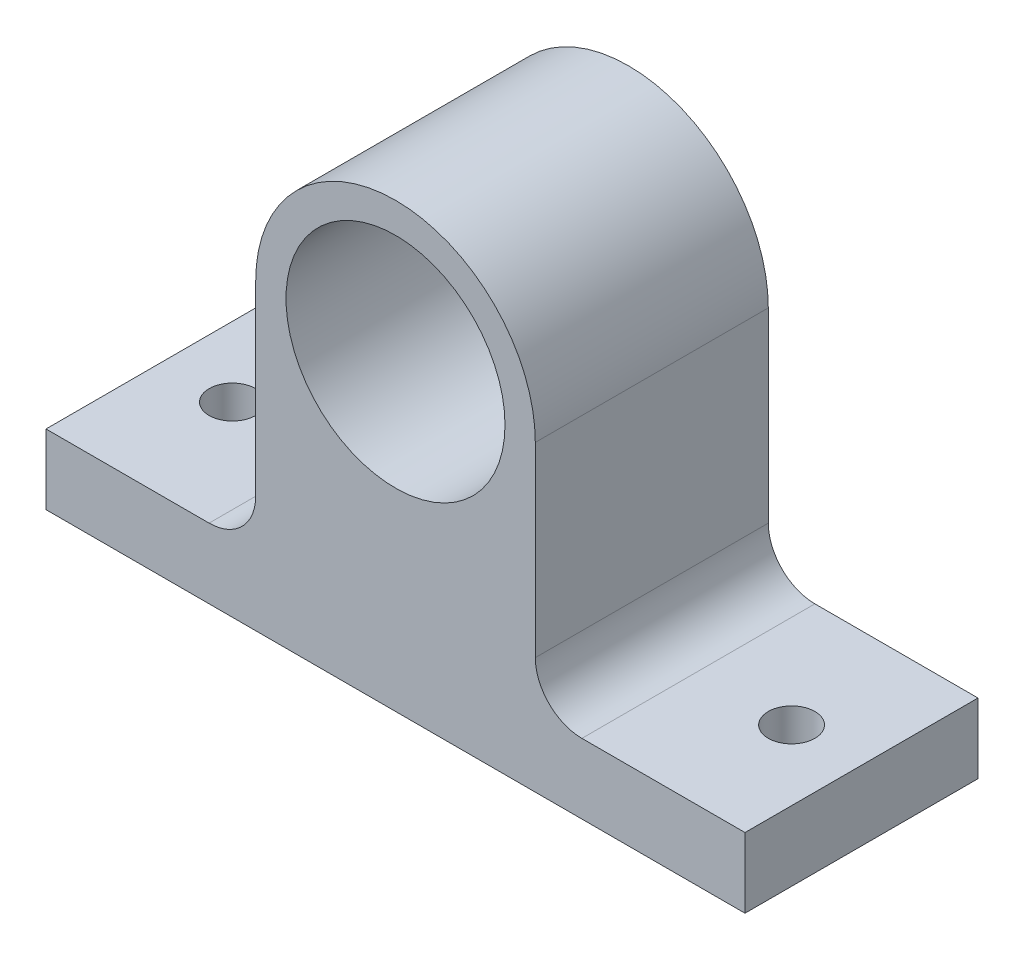
from build123d import *

# Parameters (mm, degrees)
IZIM1_R                     = 23.5
Y_KSEKLIK_EKSTR_ZYON1_DEPTH = 50
RADYUS1_R                   = 10
IZIM2_R                     = 5
KES_EKSTR_ZYON1_DEPTH       = 50


with BuildPart() as part:
    # Çizim1 → Yükseklik-Ekstrüzyon1 (new body)
    with BuildSketch(Plane.XY):
        with BuildLine():
            Line((-30, 7.5), (-30, 57.5))
            ThreePointArc((-30, 57.5), (0, 87.5), (30, 57.5))
            Line((30, 57.5), (30, 7.5))
            Line((30, 7.5), (75, 7.5))
            Line((75, 7.5), (75, -7.5))
            Line((75, -7.5), (-75, -7.5))
            Line((-75, -7.5), (-75, 7.5))
            Line((-75, 7.5), (-30, 7.5))
        make_face()
        with Locations((0, 57.5)):
            Circle(IZIM1_R, mode=Mode.SUBTRACT)
    extrude(amount=Y_KSEKLIK_EKSTR_ZYON1_DEPTH)

    # Radyus1
    radyus1_edges = [part.edges().sort_by_distance(p)[0] for p in [
        (-30, 7.5, 25),
        (30, 7.5, 25),
    ]]
    fillet(radyus1_edges, radius=RADYUS1_R)

    # Çizim2 → Kes-Ekstrüzyon1 (cut)
    with BuildSketch(Plane(origin=(0, 7.5, 0), x_dir=(1, 0, 0), z_dir=(0, 1, 0))):
        with Locations(Location((-60, -25, 0), (0, 0, 180))):
            Circle(IZIM2_R)
        with Locations(Location((60, -25, 0), (0, 0, 180))):
            Circle(IZIM2_R)
    extrude(amount=-KES_EKSTR_ZYON1_DEPTH, mode=Mode.SUBTRACT)


solid = part.part
